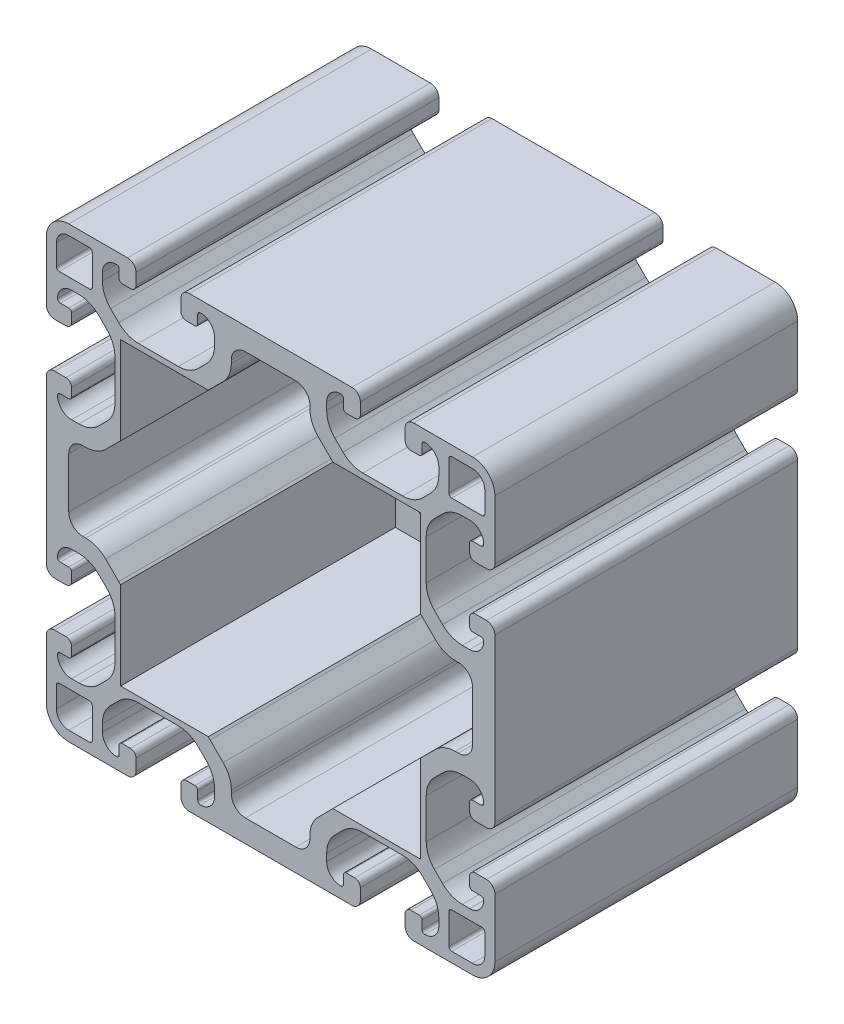
from build123d import *

# Parameters (mm, degrees)
ESQUISSE1_R             = 3.4
BOSS_EXTRU_1_DEPTH      = 54
ESQUISSE2_W             = 53.5
ESQUISSE2_H             = 53.5
ENL_V_MAT_EXTRU_1_DEPTH = 49


with BuildPart() as part:
    # Esquisse1 → Boss.-Extru.1 (new body)
    with BuildSketch(Plane(origin=(0, 0, -30), x_dir=(-1, 0, 0), z_dir=(0, 0, -1))):
        with BuildLine():
            Line((-4.5, 55), (-4.5, 53.5))
            ThreePointArc((-4.5, 53.5), (-4.353553391, 53.146446609), (-4, 53))
            Line((-4, 53), (-2.5, 53))
            ThreePointArc((-2.5, 53), (-2.146446609, 52.853553391), (-2, 52.5))
            ThreePointArc((-2, 52.5), (-2.732233047, 50.732233047), (-4.5, 50))
            Line((-4.5, 50), (-5.807611845, 50))
            ThreePointArc((-5.807611845, 50), (-7.721029006, 50.380602337), (-9.343145751, 51.464466094))
            Line((-9.343145751, 51.464466094), (-10.785533906, 52.906854249))
            ThreePointArc((-10.785533906, 52.906854249), (-11.869397663, 54.528970994), (-12.25, 56.442388155))
            Line((-12.25, 56.442388155), (-12.25, 63.557611845))
            ThreePointArc((-12.25, 63.557611845), (-11.869397663, 65.471029006), (-10.785533906, 67.093145751))
            Line((-10.785533906, 67.093145751), (-9.343145751, 68.535533906))
            ThreePointArc((-9.343145751, 68.535533906), (-7.721029006, 69.619397663), (-5.807611845, 70))
            Line((-5.807611845, 70), (-4.5, 70))
            ThreePointArc((-4.5, 70), (-2.732233047, 69.267766953), (-2, 67.5))
            ThreePointArc((-2, 67.5), (-2.146446609, 67.146446609), (-2.5, 67))
            Line((-2.5, 67), (-4, 67))
            ThreePointArc((-4, 67), (-4.353553391, 66.853553391), (-4.5, 66.5))
            Line((-4.5, 66.5), (-4.5, 65))
            ThreePointArc((-4.5, 65), (-4.207106781, 64.292893219), (-3.5, 64))
            Line((-3.5, 64), (-1.5, 64))
            ThreePointArc((-1.5, 64), (-0.439339828, 64.439339828), (0, 65.5))
            Line((0, 65.5), (0, 76))
            ThreePointArc((0, 76), (-1.171572875, 78.828427125), (-4, 80))
            Line((-4, 80), (-14.5, 80))
            ThreePointArc((-14.5, 80), (-15.560660172, 79.560660172), (-16, 78.5))
            Line((-16, 78.5), (-16, 76.5))
            ThreePointArc((-16, 76.5), (-15.707106781, 75.792893219), (-15, 75.5))
            Line((-15, 75.5), (-13.5, 75.5))
            ThreePointArc((-13.5, 75.5), (-13.146446609, 75.646446609), (-13, 76))
            Line((-13, 76), (-13, 77.5))
            ThreePointArc((-13, 77.5), (-12.853553391, 77.853553391), (-12.5, 78))
            ThreePointArc((-12.5, 78), (-10.732233047, 77.267766953), (-10, 75.5))
            Line((-10, 75.5), (-10, 74.192388155))
            ThreePointArc((-10, 74.192388155), (-10.380602337, 72.278970994), (-11.464466094, 70.656854249))
            Line((-11.464466094, 70.656854249), (-12.906854249, 69.214466094))
            ThreePointArc((-12.906854249, 69.214466094), (-14.528970994, 68.130602337), (-16.442388155, 67.75))
            Line((-16.442388155, 67.75), (-23.557611845, 67.75))
            ThreePointArc((-23.557611845, 67.75), (-25.471029006, 68.130602337), (-27.093145751, 69.214466094))
            Line((-27.093145751, 69.214466094), (-28.535533906, 70.656854249))
            ThreePointArc((-28.535533906, 70.656854249), (-29.619397663, 72.278970994), (-30, 74.192388155))
            Line((-30, 74.192388155), (-30, 75.5))
            ThreePointArc((-30, 75.5), (-29.267766953, 77.267766953), (-27.5, 78))
            ThreePointArc((-27.5, 78), (-27.146446609, 77.853553391), (-27, 77.5))
            Line((-27, 77.5), (-27, 76))
            ThreePointArc((-27, 76), (-26.853553391, 75.646446609), (-26.5, 75.5))
            Line((-26.5, 75.5), (-25, 75.5))
            ThreePointArc((-25, 75.5), (-24.292893219, 75.792893219), (-24, 76.5))
            Line((-24, 76.5), (-24, 78.5))
            ThreePointArc((-24, 78.5), (-24.439339828, 79.560660172), (-25.5, 80))
            Line((-25.5, 80), (-54.5, 80))
            ThreePointArc((-54.5, 80), (-55.560660172, 79.560660172), (-56, 78.5))
            Line((-56, 78.5), (-56, 76.5))
            ThreePointArc((-56, 76.5), (-55.707106781, 75.792893219), (-55, 75.5))
            Line((-55, 75.5), (-53.5, 75.5))
            ThreePointArc((-53.5, 75.5), (-53.146446609, 75.646446609), (-53, 76))
            Line((-53, 76), (-53, 77.5))
            ThreePointArc((-53, 77.5), (-52.853553391, 77.853553391), (-52.5, 78))
            ThreePointArc((-52.5, 78), (-50.732233047, 77.267766953), (-50, 75.5))
            Line((-50, 75.5), (-50, 74.192388155))
            ThreePointArc((-50, 74.192388155), (-50.380602337, 72.278970994), (-51.464466094, 70.656854249))
            Line((-51.464466094, 70.656854249), (-52.906854249, 69.214466094))
            ThreePointArc((-52.906854249, 69.214466094), (-54.528970994, 68.130602337), (-56.442388155, 67.75))
            Line((-56.442388155, 67.75), (-63.557611845, 67.75))
            ThreePointArc((-63.557611845, 67.75), (-65.471029006, 68.130602337), (-67.093145751, 69.214466094))
            Line((-67.093145751, 69.214466094), (-68.535533906, 70.656854249))
            ThreePointArc((-68.535533906, 70.656854249), (-69.619397663, 72.278970994), (-70, 74.192388155))
            Line((-70, 74.192388155), (-70, 75.5))
            ThreePointArc((-70, 75.5), (-69.267766953, 77.267766953), (-67.5, 78))
            ThreePointArc((-67.5, 78), (-67.146446609, 77.853553391), (-67, 77.5))
            Line((-67, 77.5), (-67, 76))
            ThreePointArc((-67, 76), (-66.853553391, 75.646446609), (-66.5, 75.5))
            Line((-66.5, 75.5), (-65, 75.5))
            ThreePointArc((-65, 75.5), (-64.292893219, 75.792893219), (-64, 76.5))
            Line((-64, 76.5), (-64, 78.5))
            ThreePointArc((-64, 78.5), (-64.439339828, 79.560660172), (-65.5, 80))
            Line((-65.5, 80), (-76, 80))
            ThreePointArc((-76, 80), (-78.828427125, 78.828427125), (-80, 76))
            Line((-80, 76), (-80, 65.5))
            ThreePointArc((-80, 65.5), (-79.560660172, 64.439339828), (-78.5, 64))
            Line((-78.5, 64), (-76.5, 64))
            ThreePointArc((-76.5, 64), (-75.792893219, 64.292893219), (-75.5, 65))
            Line((-75.5, 65), (-75.5, 66.5))
            ThreePointArc((-75.5, 66.5), (-75.646446609, 66.853553391), (-76, 67))
            Line((-76, 67), (-77.5, 67))
            ThreePointArc((-77.5, 67), (-77.853553391, 67.146446609), (-78, 67.5))
            ThreePointArc((-78, 67.5), (-77.267766953, 69.267766953), (-75.5, 70))
            Line((-75.5, 70), (-74.192388155, 70))
            ThreePointArc((-74.192388155, 70), (-72.278970994, 69.619397663), (-70.656854249, 68.535533906))
            Line((-70.656854249, 68.535533906), (-69.214466094, 67.093145751))
            ThreePointArc((-69.214466094, 67.093145751), (-68.130602337, 65.471029006), (-67.75, 63.557611845))
            Line((-67.75, 63.557611845), (-67.75, 56.442388155))
            ThreePointArc((-67.75, 56.442388155), (-68.130602337, 54.528970994), (-69.214466094, 52.906854249))
            Line((-69.214466094, 52.906854249), (-70.656854249, 51.464466094))
            ThreePointArc((-70.656854249, 51.464466094), (-72.278970994, 50.380602337), (-74.192388155, 50))
            Line((-74.192388155, 50), (-75.5, 50))
            ThreePointArc((-75.5, 50), (-77.267766953, 50.732233047), (-78, 52.5))
            ThreePointArc((-78, 52.5), (-77.853553391, 52.853553391), (-77.5, 53))
            Line((-77.5, 53), (-76, 53))
            ThreePointArc((-76, 53), (-75.646446609, 53.146446609), (-75.5, 53.5))
            Line((-75.5, 53.5), (-75.5, 55))
            ThreePointArc((-75.5, 55), (-75.792893219, 55.707106781), (-76.5, 56))
            Line((-76.5, 56), (-78.5, 56))
            ThreePointArc((-78.5, 56), (-79.560660172, 55.560660172), (-80, 54.5))
            Line((-80, 54.5), (-80, 25.5))
            ThreePointArc((-80, 25.5), (-79.560660172, 24.439339828), (-78.5, 24))
            Line((-78.5, 24), (-76.5, 24))
            ThreePointArc((-76.5, 24), (-75.792893219, 24.292893219), (-75.5, 25))
            Line((-75.5, 25), (-75.5, 26.5))
            ThreePointArc((-75.5, 26.5), (-75.646446609, 26.853553391), (-76, 27))
            Line((-76, 27), (-77.5, 27))
            ThreePointArc((-77.5, 27), (-77.853553391, 27.146446609), (-78, 27.5))
            ThreePointArc((-78, 27.5), (-77.267766953, 29.267766953), (-75.5, 30))
            Line((-75.5, 30), (-74.192388155, 30))
            ThreePointArc((-74.192388155, 30), (-72.278970994, 29.619397663), (-70.656854249, 28.535533906))
            Line((-70.656854249, 28.535533906), (-69.214466094, 27.093145751))
            ThreePointArc((-69.214466094, 27.093145751), (-68.130602337, 25.471029006), (-67.75, 23.557611845))
            Line((-67.75, 23.557611845), (-67.75, 16.442388155))
            ThreePointArc((-67.75, 16.442388155), (-68.130602337, 14.528970994), (-69.214466094, 12.906854249))
            Line((-69.214466094, 12.906854249), (-70.656854249, 11.464466094))
            ThreePointArc((-70.656854249, 11.464466094), (-72.278970994, 10.380602337), (-74.192388155, 10))
            Line((-74.192388155, 10), (-75.5, 10))
            ThreePointArc((-75.5, 10), (-77.267766953, 10.732233047), (-78, 12.5))
            ThreePointArc((-78, 12.5), (-77.853553391, 12.853553391), (-77.5, 13))
            Line((-77.5, 13), (-76, 13))
            ThreePointArc((-76, 13), (-75.646446609, 13.146446609), (-75.5, 13.5))
            Line((-75.5, 13.5), (-75.5, 15))
            ThreePointArc((-75.5, 15), (-75.792893219, 15.707106781), (-76.5, 16))
            Line((-76.5, 16), (-78.5, 16))
            ThreePointArc((-78.5, 16), (-79.560660172, 15.560660172), (-80, 14.5))
            Line((-80, 14.5), (-80, 4))
            ThreePointArc((-80, 4), (-78.828427125, 1.171572875), (-76, 0))
            Line((-76, 0), (-65.5, 0))
            ThreePointArc((-65.5, 0), (-64.439339828, 0.439339828), (-64, 1.5))
            Line((-64, 1.5), (-64, 3.5))
            ThreePointArc((-64, 3.5), (-64.292893219, 4.207106781), (-65, 4.5))
            Line((-65, 4.5), (-66.5, 4.5))
            ThreePointArc((-66.5, 4.5), (-66.853553391, 4.353553391), (-67, 4))
            Line((-67, 4), (-67, 2.5))
            ThreePointArc((-67, 2.5), (-67.146446609, 2.146446609), (-67.5, 2))
            ThreePointArc((-67.5, 2), (-69.267766953, 2.732233047), (-70, 4.5))
            Line((-70, 4.5), (-70, 5.807611845))
            ThreePointArc((-70, 5.807611845), (-69.619397663, 7.721029006), (-68.535533906, 9.343145751))
            Line((-68.535533906, 9.343145751), (-67.093145751, 10.785533906))
            ThreePointArc((-67.093145751, 10.785533906), (-65.471029006, 11.869397663), (-63.557611845, 12.25))
            Line((-63.557611845, 12.25), (-56.442388155, 12.25))
            ThreePointArc((-56.442388155, 12.25), (-54.528970994, 11.869397663), (-52.906854249, 10.785533906))
            Line((-52.906854249, 10.785533906), (-51.464466094, 9.343145751))
            ThreePointArc((-51.464466094, 9.343145751), (-50.380602337, 7.721029006), (-50, 5.807611845))
            Line((-50, 5.807611845), (-50, 4.5))
            ThreePointArc((-50, 4.5), (-50.732233047, 2.732233047), (-52.5, 2))
            ThreePointArc((-52.5, 2), (-52.853553391, 2.146446609), (-53, 2.5))
            Line((-53, 2.5), (-53, 4))
            ThreePointArc((-53, 4), (-53.146446609, 4.353553391), (-53.5, 4.5))
            Line((-53.5, 4.5), (-55, 4.5))
            ThreePointArc((-55, 4.5), (-55.707106781, 4.207106781), (-56, 3.5))
            Line((-56, 3.5), (-56, 1.5))
            ThreePointArc((-56, 1.5), (-55.560660172, 0.439339828), (-54.5, 0))
            Line((-54.5, 0), (-25.5, 0))
            ThreePointArc((-25.5, 0), (-24.439339828, 0.439339828), (-24, 1.5))
            Line((-24, 1.5), (-24, 3.5))
            ThreePointArc((-24, 3.5), (-24.292893219, 4.207106781), (-25, 4.5))
            Line((-25, 4.5), (-26.5, 4.5))
            ThreePointArc((-26.5, 4.5), (-26.853553391, 4.353553391), (-27, 4))
            Line((-27, 4), (-27, 2.5))
            ThreePointArc((-27, 2.5), (-27.146446609, 2.146446609), (-27.5, 2))
            ThreePointArc((-27.5, 2), (-29.267766953, 2.732233047), (-30, 4.5))
            Line((-30, 4.5), (-30, 5.807611845))
            ThreePointArc((-30, 5.807611845), (-29.619397663, 7.721029006), (-28.535533906, 9.343145751))
            Line((-28.535533906, 9.343145751), (-27.093145751, 10.785533906))
            ThreePointArc((-27.093145751, 10.785533906), (-25.471029006, 11.869397663), (-23.557611845, 12.25))
            Line((-23.557611845, 12.25), (-16.442388155, 12.25))
            ThreePointArc((-16.442388155, 12.25), (-14.528970994, 11.869397663), (-12.906854249, 10.785533906))
            Line((-12.906854249, 10.785533906), (-11.464466094, 9.343145751))
            ThreePointArc((-11.464466094, 9.343145751), (-10.380602337, 7.721029006), (-10, 5.807611845))
            Line((-10, 5.807611845), (-10, 4.5))
            ThreePointArc((-10, 4.5), (-10.732233047, 2.732233047), (-12.5, 2))
            ThreePointArc((-12.5, 2), (-12.853553391, 2.146446609), (-13, 2.5))
            Line((-13, 2.5), (-13, 4))
            ThreePointArc((-13, 4), (-13.146446609, 4.353553391), (-13.5, 4.5))
            Line((-13.5, 4.5), (-15, 4.5))
            ThreePointArc((-15, 4.5), (-15.707106781, 4.207106781), (-16, 3.5))
            Line((-16, 3.5), (-16, 1.5))
            ThreePointArc((-16, 1.5), (-15.560660172, 0.439339828), (-14.5, 0))
            Line((-14.5, 0), (-4, 0))
            ThreePointArc((-4, 0), (-1.171572875, 1.171572875), (0, 4))
            Line((0, 4), (0, 14.5))
            ThreePointArc((0, 14.5), (-0.439339828, 15.560660172), (-1.5, 16))
            Line((-1.5, 16), (-3.5, 16))
            ThreePointArc((-3.5, 16), (-4.207106781, 15.707106781), (-4.5, 15))
            Line((-4.5, 15), (-4.5, 13.5))
            ThreePointArc((-4.5, 13.5), (-4.353553391, 13.146446609), (-4, 13))
            Line((-4, 13), (-2.5, 13))
            ThreePointArc((-2.5, 13), (-2.146446609, 12.853553391), (-2, 12.5))
            ThreePointArc((-2, 12.5), (-2.732233047, 10.732233047), (-4.5, 10))
            Line((-4.5, 10), (-5.807611845, 10))
            ThreePointArc((-5.807611845, 10), (-7.721029006, 10.380602337), (-9.343145751, 11.464466094))
            Line((-9.343145751, 11.464466094), (-10.785533906, 12.906854249))
            ThreePointArc((-10.785533906, 12.906854249), (-11.869397663, 14.528970994), (-12.25, 16.442388155))
            Line((-12.25, 16.442388155), (-12.25, 23.557611845))
            ThreePointArc((-12.25, 23.557611845), (-11.869397663, 25.471029006), (-10.785533906, 27.093145751))
            Line((-10.785533906, 27.093145751), (-9.343145751, 28.535533906))
            ThreePointArc((-9.343145751, 28.535533906), (-7.721029006, 29.619397663), (-5.807611845, 30))
            Line((-5.807611845, 30), (-4.5, 30))
            ThreePointArc((-4.5, 30), (-2.732233047, 29.267766953), (-2, 27.5))
            ThreePointArc((-2, 27.5), (-2.146446609, 27.146446609), (-2.5, 27))
            Line((-2.5, 27), (-4, 27))
            ThreePointArc((-4, 27), (-4.353553391, 26.853553391), (-4.5, 26.5))
            Line((-4.5, 26.5), (-4.5, 25))
            ThreePointArc((-4.5, 25), (-4.207106781, 24.292893219), (-3.5, 24))
            Line((-3.5, 24), (-1.5, 24))
            ThreePointArc((-1.5, 24), (-0.439339828, 24.439339828), (0, 25.5))
            Line((0, 25.5), (0, 54.5))
            ThreePointArc((0, 54.5), (-0.439339828, 55.560660172), (-1.5, 56))
            Line((-1.5, 56), (-3.5, 56))
            ThreePointArc((-3.5, 56), (-4.207106781, 55.707106781), (-4.5, 55))
        make_face()
        with Locations(Location((-20, 20, 0), (0, 0, 180))):
            Circle(ESQUISSE1_R, mode=Mode.SUBTRACT)
        with Locations(Location((-20, 60, 0), (0, 0, 180))):
            Circle(ESQUISSE1_R, mode=Mode.SUBTRACT)
        with Locations(Location((-60, 20, 0), (0, 0, 180))):
            Circle(ESQUISSE1_R, mode=Mode.SUBTRACT)
        with Locations(Location((-60, 60, 0), (0, 0, 180))):
            Circle(ESQUISSE1_R, mode=Mode.SUBTRACT)
        with BuildLine():
            Line((-24.112175362, 27.603553391), (-27.603553391, 24.112175362))
            ThreePointArc((-27.603553391, 24.112175362), (-27.711939766, 23.949963688), (-27.75, 23.758621971))
            Line((-27.75, 23.758621971), (-27.75, 16.442388155))
            ThreePointArc((-27.75, 16.442388155), (-28.130602337, 14.528970994), (-29.214466094, 12.906854249))
            Line((-29.214466094, 12.906854249), (-31.535533906, 10.585786438))
            ThreePointArc((-31.535533906, 10.585786438), (-32.619397663, 8.963669694), (-33, 7.050252532))
            Line((-33, 7.050252532), (-33, 6.5))
            ThreePointArc((-33, 6.5), (-33.732233047, 4.732233047), (-35.5, 4))
            Line((-35.5, 4), (-44.5, 4))
            ThreePointArc((-44.5, 4), (-46.267766953, 4.732233047), (-47, 6.5))
            Line((-47, 6.5), (-47, 7.050252532))
            ThreePointArc((-47, 7.050252532), (-47.380602337, 8.963669694), (-48.464466094, 10.585786438))
            Line((-48.464466094, 10.585786438), (-50.785533906, 12.906854249))
            ThreePointArc((-50.785533906, 12.906854249), (-51.869397663, 14.528970994), (-52.25, 16.442388155))
            Line((-52.25, 16.442388155), (-52.25, 23.758621971))
            ThreePointArc((-52.25, 23.758621971), (-52.288060234, 23.949963688), (-52.396446609, 24.112175362))
            Line((-52.396446609, 24.112175362), (-55.887824638, 27.603553391))
            ThreePointArc((-55.887824638, 27.603553391), (-56.050036312, 27.711939766), (-56.241378029, 27.75))
            Line((-56.241378029, 27.75), (-63.557611845, 27.75))
            ThreePointArc((-63.557611845, 27.75), (-65.471029006, 28.130602337), (-67.09314575, 29.214466094))
            Line((-67.09314575, 29.214466094), (-69.414213562, 31.535533906))
            ThreePointArc((-69.414213562, 31.535533906), (-71.036330306, 32.619397663), (-72.949747468, 33))
            Line((-72.949747468, 33), (-73.5, 33))
            ThreePointArc((-73.5, 33), (-75.267766953, 33.732233047), (-76, 35.5))
            Line((-76, 35.5), (-76, 44.5))
            ThreePointArc((-76, 44.5), (-75.267766953, 46.267766953), (-73.5, 47))
            Line((-73.5, 47), (-72.949747468, 47))
            ThreePointArc((-72.949747468, 47), (-71.036330306, 47.380602337), (-69.414213562, 48.464466094))
            Line((-69.414213562, 48.464466094), (-67.09314575, 50.785533906))
            ThreePointArc((-67.09314575, 50.785533906), (-65.471029006, 51.869397663), (-63.557611845, 52.25))
            Line((-63.557611845, 52.25), (-56.241378029, 52.25))
            ThreePointArc((-56.241378029, 52.25), (-56.050036312, 52.288060234), (-55.887824638, 52.396446609))
            Line((-55.887824638, 52.396446609), (-52.396446609, 55.887824638))
            ThreePointArc((-52.396446609, 55.887824638), (-52.288060234, 56.050036312), (-52.25, 56.241378029))
            Line((-52.25, 56.241378029), (-52.25, 63.557611845))
            ThreePointArc((-52.25, 63.557611845), (-51.869397663, 65.471029006), (-50.785533906, 67.09314575))
            Line((-50.785533906, 67.09314575), (-48.464466094, 69.414213562))
            ThreePointArc((-48.464466094, 69.414213562), (-47.380602337, 71.036330306), (-47, 72.949747468))
            Line((-47, 72.949747468), (-47, 73.5))
            ThreePointArc((-47, 73.5), (-46.267766953, 75.267766953), (-44.5, 76))
            Line((-44.5, 76), (-35.5, 76))
            ThreePointArc((-35.5, 76), (-33.732233047, 75.267766953), (-33, 73.5))
            Line((-33, 73.5), (-33, 72.949747468))
            ThreePointArc((-33, 72.949747468), (-32.619397663, 71.036330306), (-31.535533906, 69.414213562))
            Line((-31.535533906, 69.414213562), (-29.214466094, 67.09314575))
            ThreePointArc((-29.214466094, 67.09314575), (-28.130602337, 65.471029006), (-27.75, 63.557611845))
            Line((-27.75, 63.557611845), (-27.75, 56.241378029))
            ThreePointArc((-27.75, 56.241378029), (-27.711939766, 56.050036312), (-27.603553391, 55.887824638))
            Line((-27.603553391, 55.887824638), (-24.112175362, 52.396446609))
            ThreePointArc((-24.112175362, 52.396446609), (-23.949963688, 52.288060234), (-23.758621971, 52.25))
            Line((-23.758621971, 52.25), (-16.442388155, 52.25))
            ThreePointArc((-16.442388155, 52.25), (-14.528970994, 51.869397663), (-12.906854249, 50.785533906))
            Line((-12.906854249, 50.785533906), (-10.585786438, 48.464466094))
            ThreePointArc((-10.585786438, 48.464466094), (-8.963669694, 47.380602337), (-7.050252532, 47))
            Line((-7.050252532, 47), (-6.5, 47))
            ThreePointArc((-6.5, 47), (-4.732233047, 46.267766953), (-4, 44.5))
            Line((-4, 44.5), (-4, 35.5))
            ThreePointArc((-4, 35.5), (-4.73303314, 33.73303314), (-6.5, 33))
            Line((-6.5, 33), (-7.050252532, 33))
            ThreePointArc((-7.050252532, 33), (-8.963669694, 32.619397663), (-10.585786438, 31.535533906))
            Line((-10.585786438, 31.535533906), (-12.906854249, 29.214466094))
            ThreePointArc((-12.906854249, 29.214466094), (-14.528970994, 28.130602337), (-16.442388155, 27.75))
            Line((-16.442388155, 27.75), (-23.758621971, 27.75))
            ThreePointArc((-23.758621971, 27.75), (-23.949963688, 27.711939766), (-24.112175362, 27.603553391))
        make_face(mode=Mode.SUBTRACT)
        with BuildLine():
            Line((-4, 1.8), (-7.7, 1.8))
            ThreePointArc((-7.7, 1.8), (-8.053553391, 1.946446609), (-8.2, 2.3))
            Line((-8.2, 2.3), (-8.2, 7.7))
            ThreePointArc((-8.2, 7.7), (-8.053553391, 8.053553391), (-7.7, 8.2))
            Line((-7.7, 8.2), (-2.3, 8.2))
            ThreePointArc((-2.3, 8.2), (-1.946446609, 8.053553391), (-1.8, 7.7))
            Line((-1.8, 7.7), (-1.8, 4))
            ThreePointArc((-1.8, 4), (-2.444365081, 2.444365081), (-4, 1.8))
        make_face(mode=Mode.SUBTRACT)
        with BuildLine():
            Line((-78.2, 4), (-78.2, 7.7))
            ThreePointArc((-78.2, 7.7), (-78.053553391, 8.053553391), (-77.7, 8.2))
            Line((-77.7, 8.2), (-72.3, 8.2))
            ThreePointArc((-72.3, 8.2), (-71.946446609, 8.053553391), (-71.8, 7.7))
            Line((-71.8, 7.7), (-71.8, 2.3))
            ThreePointArc((-71.8, 2.3), (-71.946446609, 1.946446609), (-72.3, 1.8))
            Line((-72.3, 1.8), (-76, 1.8))
            ThreePointArc((-76, 1.8), (-77.555634919, 2.444365081), (-78.2, 4))
        make_face(mode=Mode.SUBTRACT)
        with BuildLine():
            Line((-76, 78.2), (-72.3, 78.2))
            ThreePointArc((-72.3, 78.2), (-71.946446609, 78.053553391), (-71.8, 77.7))
            Line((-71.8, 77.7), (-71.8, 72.3))
            ThreePointArc((-71.8, 72.3), (-71.946446609, 71.946446609), (-72.3, 71.8))
            Line((-72.3, 71.8), (-77.7, 71.8))
            ThreePointArc((-77.7, 71.8), (-78.053553391, 71.946446609), (-78.2, 72.3))
            Line((-78.2, 72.3), (-78.2, 76))
            ThreePointArc((-78.2, 76), (-77.555634919, 77.555634919), (-76, 78.2))
        make_face(mode=Mode.SUBTRACT)
        with BuildLine():
            Line((-1.8, 76), (-1.8, 72.3))
            ThreePointArc((-1.8, 72.3), (-1.946446609, 71.946446609), (-2.3, 71.8))
            Line((-2.3, 71.8), (-7.7, 71.8))
            ThreePointArc((-7.7, 71.8), (-8.053553391, 71.946446609), (-8.2, 72.3))
            Line((-8.2, 72.3), (-8.2, 77.7))
            ThreePointArc((-8.2, 77.7), (-8.053553391, 78.053553391), (-7.7, 78.2))
            Line((-7.7, 78.2), (-4, 78.2))
            ThreePointArc((-4, 78.2), (-2.444365081, 77.555634919), (-1.8, 76))
        make_face(mode=Mode.SUBTRACT)
    extrude(amount=-BOSS_EXTRU_1_DEPTH)

    # Esquisse2 → Enlèv. mat.-Extru.1 (cut)
    with BuildSketch(Plane.XY.offset(24)):
        with Locations((40, 40)):
            Rectangle(ESQUISSE2_W, ESQUISSE2_H)
    extrude(amount=-ENL_V_MAT_EXTRU_1_DEPTH, mode=Mode.SUBTRACT)


solid = part.part
